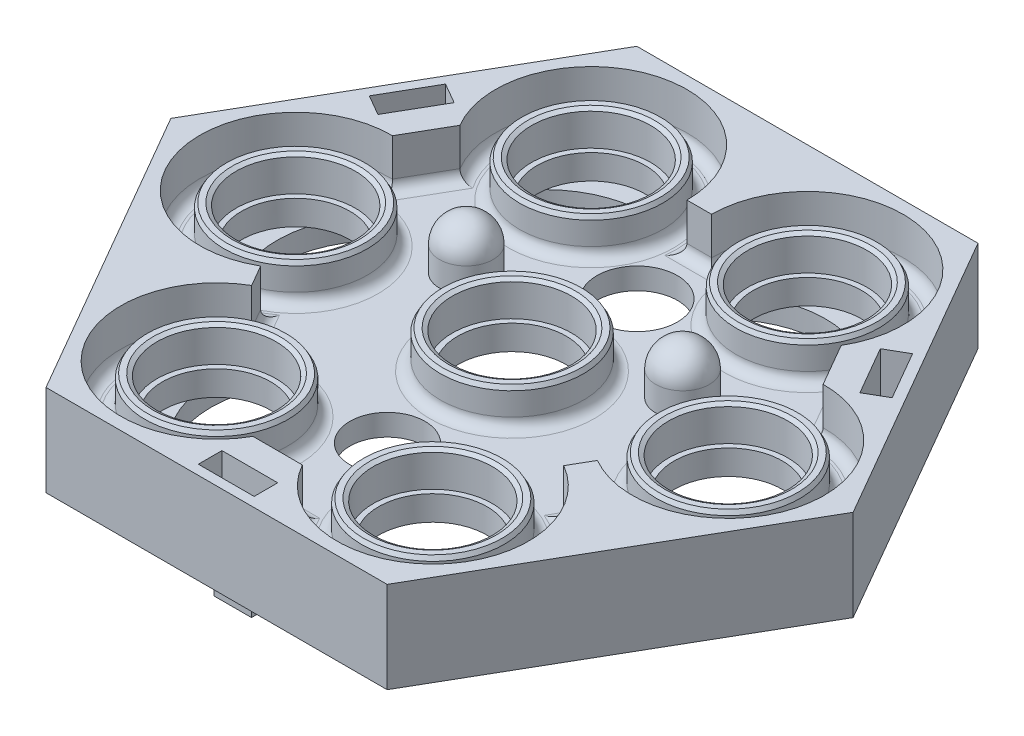
from build123d import *
from OCP.BRepFilletAPI import BRepFilletAPI_MakeChamfer

# Parameters (mm, degrees)
BOSS_EXTRUDE1_DEPTH = 28.05
BOSS_EXTRUDE2_START = -4.004
SKETCH3_R           = 10.1
BOSS_EXTRUDE2_DEPTH = 4.004
SKETCH3_3_R         = 11.1
SKETCH3_3_R_2       = 10.1
BOSS_EXTRUDE3_DEPTH = 0.6
SKETCH3_4_R         = 13.35
SKETCH3_4_R_2       = 11.1
BOSS_EXTRUDE4_DEPTH = 7
CHAMFER1_SIZE       = 0.75
CHAMFER1_SIZE2      = 0.433012702
SKETCH4_W           = 7
SKETCH4_H           = 3
BOSS_EXTRUDE5_DEPTH = 4
SKETCH5_R           = 2.175
CUT_EXTRUDE1_DEPTH  = 11.05
FILLET2_R           = 2
CUT_EXTRUDE2_DEPTH  = 87.445405368
SKETCH7_R           = 2.175
CUT_EXTRUDE3_DEPTH  = 11.05
SKETCH8_R           = 5
BOSS_EXTRUDE6_DEPTH = 4.6
REVOLVE1_ANGLE      = 180
CIRPATTERN1_COUNT   = 2
CIRPATTERN1_ANGLE   = 120
SKETCH10_W          = 10.4
SKETCH10_H          = 4.4
CUT_EXTRUDE4_DEPTH  = 11
BOSS_EXTRUDE7_START = -4
SKETCH11_W          = 7
SKETCH11_H          = 3
BOSS_EXTRUDE7_DEPTH = 4


with BuildPart() as part:
    # Sketch1 → Boss-Extrude1 (new body)
    with BuildSketch(Plane(origin=(0, 0, 0), x_dir=(1, 0, 0), z_dir=(0, 1, 0))):
        with BuildLine():
            ThreePointArc((4.598585794, -43.670987935), (15.441921389, -52.121912551), (29.0763555, -50.361725025))
            Line((29.0763555, -50.361725025), (31.782668218, -55.049196153))
            Line((31.782668218, -55.049196153), (-31.782668218, -55.049196153))
            Line((-31.782668218, -55.049196153), (-63.565336435, 0))
            Line((-63.565336435, 0), (-58.152711, 0))
            ThreePointArc((-58.152711, 0), (-49.22575975, -15.461933122), (-31.37185725, -15.461933122))
            Line((-31.37185725, -15.461933122), (-29.0763555, -19.437858782))
            ThreePointArc((-29.0763555, -19.437858782), (-32.710456807, -47.587651973), (-4.598585794, -43.670987935))
            Line((-4.598585794, -43.670987935), (4.598585794, -43.670987935))
        make_face()
        with BuildLine():
            ThreePointArc((-40.119477858, 17.853001848), (-52.859861057, 12.687860069), (-58.152711, 0))
            Line((-58.152711, 0), (-63.565336435, 0))
            Line((-63.565336435, 0), (-31.782668218, 55.049196153))
            Line((-31.782668218, 55.049196153), (31.782668218, 55.049196153))
            Line((31.782668218, 55.049196153), (29.0763555, 50.361725025))
            ThreePointArc((29.0763555, 50.361725025), (11.222453, 50.361725025), (2.29550175, 34.899791903))
            Line((2.29550175, 34.899791903), (-2.29550175, 34.899791903))
            ThreePointArc((-2.29550175, 34.899791903), (-24.856887111, 52.121912551), (-35.520892063, 25.817986087))
            Line((-35.520892063, 25.817986087), (-40.119477858, 17.853001848))
        make_face()
        with BuildLine():
            ThreePointArc((35.520892063, 25.817986087), (37.417939668, 39.434052481), (29.0763555, 50.361725025))
            Line((29.0763555, 50.361725025), (31.782668218, 55.049196153))
            Line((31.782668218, 55.049196153), (63.565336435, 0))
            Line((63.565336435, 0), (31.782668218, -55.049196153))
            Line((31.782668218, -55.049196153), (29.0763555, -50.361725025))
            ThreePointArc((29.0763555, -50.361725025), (38.00330675, -34.899791903), (29.0763555, -19.437858782))
            Line((29.0763555, -19.437858782), (31.37185725, -15.461933122))
            ThreePointArc((31.37185725, -15.461933122), (57.567343918, -4.534260578), (40.119477858, 17.853001848))
            Line((40.119477858, 17.853001848), (35.520892063, 25.817986087))
        make_face()
    extrude(amount=-BOSS_EXTRUDE1_DEPTH)

    # Sketch3 → Boss-Extrude2 (add)
    with BuildSketch(Plane(origin=(0, -20.046, 0), x_dir=(1, 0, 0), z_dir=(0, 1, 0)).offset(BOSS_EXTRUDE2_START)):
        with BuildLine():
            Line((-31.37185725, -15.461933122), (-29.0763555, -19.437858782))
            ThreePointArc((-29.0763555, -19.437858782), (-32.710456807, -47.587651973), (-4.598585794, -43.670987935))
            Line((-4.598585794, -43.670987935), (4.598585794, -43.670987935))
            ThreePointArc((4.598585794, -43.670987935), (32.710456807, -47.587651973), (29.0763555, -19.437858782))
            Line((29.0763555, -19.437858782), (31.37185725, -15.461933122))
            ThreePointArc((31.37185725, -15.461933122), (57.567343918, -4.534260578), (40.119477858, 17.853001848))
            Line((40.119477858, 17.853001848), (35.520892063, 25.817986087))
            ThreePointArc((35.520892063, 25.817986087), (24.856887111, 52.121912551), (2.29550175, 34.899791903))
            Line((2.29550175, 34.899791903), (-2.29550175, 34.899791903))
            ThreePointArc((-2.29550175, 34.899791903), (-24.856887111, 52.121912551), (-35.520892063, 25.817986087))
            Line((-35.520892063, 25.817986087), (-40.119477858, 17.853001848))
            ThreePointArc((-40.119477858, 17.853001848), (-57.567343918, -4.534260578), (-31.37185725, -15.461933122))
        make_face()
        with Locations(Location((-20.14940425, 34.899791903, 0), (0, 0, 270))):
            Circle(SKETCH3_R, mode=Mode.SUBTRACT)
        with Locations(Location((0, 0, 0), (0, 0, 270))):
            Circle(SKETCH3_R, mode=Mode.SUBTRACT)
        with Locations(Location((20.14940425, 34.899791903, 0), (0, 0, 270))):
            Circle(SKETCH3_R, mode=Mode.SUBTRACT)
        with Locations(Location((40.2988085, 0, 0), (0, 0, 270))):
            Circle(SKETCH3_R, mode=Mode.SUBTRACT)
        with Locations(Location((20.14940425, -34.899791903, 0), (0, 0, 270))):
            Circle(SKETCH3_R, mode=Mode.SUBTRACT)
        with Locations(Location((-20.14940425, -34.899791903, 0), (0, 0, 270))):
            Circle(SKETCH3_R, mode=Mode.SUBTRACT)
        with Locations(Location((-40.2988085, 0, 0), (0, 0, 270))):
            Circle(SKETCH3_R, mode=Mode.SUBTRACT)
    extrude(amount=BOSS_EXTRUDE2_DEPTH)

    # Sketch3<3> → Boss-Extrude3 (add)
    # profile 1 of 7: a face of its own
    with BuildSketch(Plane(origin=(0, -20.046, 0), x_dir=(1, 0, 0), z_dir=(0, 1, 0))):
        with Locations(Location((0, 0, 0), (0, 0, 270))):
            Circle(SKETCH3_3_R)
        with Locations(Location((0, 0, 0), (0, 0, 270))):
            Circle(SKETCH3_3_R_2, mode=Mode.SUBTRACT)
    # profile 2 of 7: a face of its own
    with BuildSketch(Plane(origin=(0, -20.046, 0), x_dir=(1, 0, 0), z_dir=(0, 1, 0))):
        with Locations(Location((-40.2988085, 0, 0), (0, 0, 270))):
            Circle(SKETCH3_3_R)
        with Locations(Location((-40.2988085, 0, 0), (0, 0, 270))):
            Circle(SKETCH3_3_R_2, mode=Mode.SUBTRACT)
    # profile 3 of 7: a face of its own
    with BuildSketch(Plane(origin=(0, -20.046, 0), x_dir=(1, 0, 0), z_dir=(0, 1, 0))):
        with Locations(Location((-20.14940425, 34.899791903, 0), (0, 0, 270))):
            Circle(SKETCH3_3_R)
        with Locations(Location((-20.14940425, 34.899791903, 0), (0, 0, 270))):
            Circle(SKETCH3_3_R_2, mode=Mode.SUBTRACT)
    # profile 4 of 7: a face of its own
    with BuildSketch(Plane(origin=(0, -20.046, 0), x_dir=(1, 0, 0), z_dir=(0, 1, 0))):
        with Locations(Location((-20.14940425, -34.899791903, 0), (0, 0, 270))):
            Circle(SKETCH3_3_R)
        with Locations(Location((-20.14940425, -34.899791903, 0), (0, 0, 270))):
            Circle(SKETCH3_3_R_2, mode=Mode.SUBTRACT)
    # profile 5 of 7: a face of its own
    with BuildSketch(Plane(origin=(0, -20.046, 0), x_dir=(1, 0, 0), z_dir=(0, 1, 0))):
        with Locations(Location((20.14940425, -34.899791903, 0), (0, 0, 270))):
            Circle(SKETCH3_3_R)
        with Locations(Location((20.14940425, -34.899791903, 0), (0, 0, 270))):
            Circle(SKETCH3_3_R_2, mode=Mode.SUBTRACT)
    # profile 6 of 7: a face of its own
    with BuildSketch(Plane(origin=(0, -20.046, 0), x_dir=(1, 0, 0), z_dir=(0, 1, 0))):
        with Locations(Location((20.14940425, 34.899791903, 0), (0, 0, 270))):
            Circle(SKETCH3_3_R)
        with Locations(Location((20.14940425, 34.899791903, 0), (0, 0, 270))):
            Circle(SKETCH3_3_R_2, mode=Mode.SUBTRACT)
    # profile 7 of 7: a face of its own
    with BuildSketch(Plane(origin=(0, -20.046, 0), x_dir=(1, 0, 0), z_dir=(0, 1, 0))):
        with Locations(Location((40.2988085, 0, 0), (0, 0, 270))):
            Circle(SKETCH3_3_R)
        with Locations(Location((40.2988085, 0, 0), (0, 0, 270))):
            Circle(SKETCH3_3_R_2, mode=Mode.SUBTRACT)
    extrude(amount=BOSS_EXTRUDE3_DEPTH)

    # Sketch3<4> → Boss-Extrude4 (add)
    # profile 1 of 7: a face of its own
    with BuildSketch(Plane(origin=(0, -20.046, 0), x_dir=(1, 0, 0), z_dir=(0, 1, 0))):
        with Locations(Location((-40.2988085, 0, 0), (0, 0, 270))):
            Circle(SKETCH3_4_R)
        with Locations(Location((-40.2988085, 0, 0), (0, 0, 270))):
            Circle(SKETCH3_4_R_2, mode=Mode.SUBTRACT)
    # profile 2 of 7: a face of its own
    with BuildSketch(Plane(origin=(0, -20.046, 0), x_dir=(1, 0, 0), z_dir=(0, 1, 0))):
        with Locations(Location((0, 0, 0), (0, 0, 270))):
            Circle(SKETCH3_4_R)
        with Locations(Location((0, 0, 0), (0, 0, 270))):
            Circle(SKETCH3_4_R_2, mode=Mode.SUBTRACT)
    # profile 3 of 7: a face of its own
    with BuildSketch(Plane(origin=(0, -20.046, 0), x_dir=(1, 0, 0), z_dir=(0, 1, 0))):
        with Locations(Location((-20.14940425, 34.899791903, 0), (0, 0, 270))):
            Circle(SKETCH3_4_R)
        with Locations(Location((-20.14940425, 34.899791903, 0), (0, 0, 270))):
            Circle(SKETCH3_4_R_2, mode=Mode.SUBTRACT)
    # profile 4 of 7: a face of its own
    with BuildSketch(Plane(origin=(0, -20.046, 0), x_dir=(1, 0, 0), z_dir=(0, 1, 0))):
        with Locations(Location((-20.14940425, -34.899791903, 0), (0, 0, 270))):
            Circle(SKETCH3_4_R)
        with Locations(Location((-20.14940425, -34.899791903, 0), (0, 0, 270))):
            Circle(SKETCH3_4_R_2, mode=Mode.SUBTRACT)
    # profile 5 of 7: a face of its own
    with BuildSketch(Plane(origin=(0, -20.046, 0), x_dir=(1, 0, 0), z_dir=(0, 1, 0))):
        with Locations(Location((40.2988085, 0, 0), (0, 0, 270))):
            Circle(SKETCH3_4_R)
        with Locations(Location((40.2988085, 0, 0), (0, 0, 270))):
            Circle(SKETCH3_4_R_2, mode=Mode.SUBTRACT)
    # profile 6 of 7: a face of its own
    with BuildSketch(Plane(origin=(0, -20.046, 0), x_dir=(1, 0, 0), z_dir=(0, 1, 0))):
        with Locations(Location((20.14940425, -34.899791903, 0), (0, 0, 270))):
            Circle(SKETCH3_4_R)
        with Locations(Location((20.14940425, -34.899791903, 0), (0, 0, 270))):
            Circle(SKETCH3_4_R_2, mode=Mode.SUBTRACT)
    # profile 7 of 7: a face of its own
    with BuildSketch(Plane(origin=(0, -20.046, 0), x_dir=(1, 0, 0), z_dir=(0, 1, 0))):
        with Locations(Location((20.14940425, 34.899791903, 0), (0, 0, 270))):
            Circle(SKETCH3_4_R)
        with Locations(Location((20.14940425, 34.899791903, 0), (0, 0, 270))):
            Circle(SKETCH3_4_R_2, mode=Mode.SUBTRACT)
    extrude(amount=BOSS_EXTRUDE4_DEPTH)

    # Chamfer1: one chamfer whose edges measure the first distance from different faces: ONE call of the kernel's chamfer builder (chamfer() names one face for all edges)
    chamfer1_edges_1 = [part.edges().sort_by_distance(p)[0] for p in [
        (40.2988085, -13.046, -11.1),
    ]]
    chamfer1_side_1 = [part.faces().sort_by_distance(p)[0] for p in [
        (40.2988085, -13.046, -12.972404979),
    ]]
    chamfer1_edges_2 = [part.edges().sort_by_distance(p)[0] for p in [
        (40.2988085, -13.046, -13.35),
    ]]
    chamfer1_side_2 = [part.faces().sort_by_distance(p)[0] for p in [
        (40.2988085, -16.546, -13.35),
    ]]
    chamfer1_edges_3 = [part.edges().sort_by_distance(p)[0] for p in [
        (-20.14940425, -13.046, 23.799791903),
    ]]
    chamfer1_side_3 = [part.faces().sort_by_distance(p)[0] for p in [
        (-20.14940425, -13.046, 21.927386924),
    ]]
    chamfer1_edges_4 = [part.edges().sort_by_distance(p)[0] for p in [
        (-20.14940425, -13.046, 21.549791903),
    ]]
    chamfer1_side_4 = [part.faces().sort_by_distance(p)[0] for p in [
        (-20.14940425, -16.546, 21.549791903),
    ]]
    chamfer1_edges_5 = [part.edges().sort_by_distance(p)[0] for p in [
        (-20.14940425, -13.046, -45.999791903),
    ]]
    chamfer1_side_5 = [part.faces().sort_by_distance(p)[0] for p in [
        (-20.14940425, -13.046, -47.872196882),
    ]]
    chamfer1_edges_6 = [part.edges().sort_by_distance(p)[0] for p in [
        (-20.14940425, -13.046, -48.249791903),
    ]]
    chamfer1_side_6 = [part.faces().sort_by_distance(p)[0] for p in [
        (-20.14940425, -16.546, -48.249791903),
    ]]
    chamfer1_edges_7 = [part.edges().sort_by_distance(p)[0] for p in [
        (0, -13.046, -11.1),
    ]]
    chamfer1_side_7 = [part.faces().sort_by_distance(p)[0] for p in [
        (0, -13.046, -12.972404979),
    ]]
    chamfer1_edges_8 = [part.edges().sort_by_distance(p)[0] for p in [
        (0, -13.046, -13.35),
    ]]
    chamfer1_side_8 = [part.faces().sort_by_distance(p)[0] for p in [
        (0, -16.546, -13.35),
    ]]
    chamfer1_edges_9 = [part.edges().sort_by_distance(p)[0] for p in [
        (20.14940425, -13.046, 23.799791903),
    ]]
    chamfer1_side_9 = [part.faces().sort_by_distance(p)[0] for p in [
        (20.14940425, -13.046, 21.927386924),
    ]]
    chamfer1_edges_10 = [part.edges().sort_by_distance(p)[0] for p in [
        (20.14940425, -13.046, 21.549791903),
    ]]
    chamfer1_side_10 = [part.faces().sort_by_distance(p)[0] for p in [
        (20.14940425, -16.546, 21.549791903),
    ]]
    chamfer1_edges_11 = [part.edges().sort_by_distance(p)[0] for p in [
        (20.14940425, -13.046, -45.999791903),
    ]]
    chamfer1_side_11 = [part.faces().sort_by_distance(p)[0] for p in [
        (20.14940425, -13.046, -47.872196882),
    ]]
    chamfer1_edges_12 = [part.edges().sort_by_distance(p)[0] for p in [
        (20.14940425, -13.046, -48.249791903),
    ]]
    chamfer1_side_12 = [part.faces().sort_by_distance(p)[0] for p in [
        (20.14940425, -16.546, -48.249791903),
    ]]
    chamfer1_edges_13 = [part.edges().sort_by_distance(p)[0] for p in [
        (-40.2988085, -13.046, -11.1),
    ]]
    chamfer1_side_13 = [part.faces().sort_by_distance(p)[0] for p in [
        (-40.2988085, -13.046, -12.972404979),
    ]]
    chamfer1_edges_14 = [part.edges().sort_by_distance(p)[0] for p in [
        (-40.2988085, -13.046, -13.35),
    ]]
    chamfer1_side_14 = [part.faces().sort_by_distance(p)[0] for p in [
        (-40.2988085, -16.546, -13.35),
    ]]
    chamfer1 = BRepFilletAPI_MakeChamfer(part.part.solid().wrapped)
    for e in chamfer1_edges_1:
        chamfer1.Add(CHAMFER1_SIZE, CHAMFER1_SIZE2, e.wrapped, chamfer1_side_1[0].wrapped)  # the first distance lies on this face
    for e in chamfer1_edges_2:
        chamfer1.Add(CHAMFER1_SIZE, CHAMFER1_SIZE2, e.wrapped, chamfer1_side_2[0].wrapped)  # the first distance lies on this face
    for e in chamfer1_edges_3:
        chamfer1.Add(CHAMFER1_SIZE, CHAMFER1_SIZE2, e.wrapped, chamfer1_side_3[0].wrapped)  # the first distance lies on this face
    for e in chamfer1_edges_4:
        chamfer1.Add(CHAMFER1_SIZE, CHAMFER1_SIZE2, e.wrapped, chamfer1_side_4[0].wrapped)  # the first distance lies on this face
    for e in chamfer1_edges_5:
        chamfer1.Add(CHAMFER1_SIZE, CHAMFER1_SIZE2, e.wrapped, chamfer1_side_5[0].wrapped)  # the first distance lies on this face
    for e in chamfer1_edges_6:
        chamfer1.Add(CHAMFER1_SIZE, CHAMFER1_SIZE2, e.wrapped, chamfer1_side_6[0].wrapped)  # the first distance lies on this face
    for e in chamfer1_edges_7:
        chamfer1.Add(CHAMFER1_SIZE, CHAMFER1_SIZE2, e.wrapped, chamfer1_side_7[0].wrapped)  # the first distance lies on this face
    for e in chamfer1_edges_8:
        chamfer1.Add(CHAMFER1_SIZE, CHAMFER1_SIZE2, e.wrapped, chamfer1_side_8[0].wrapped)  # the first distance lies on this face
    for e in chamfer1_edges_9:
        chamfer1.Add(CHAMFER1_SIZE, CHAMFER1_SIZE2, e.wrapped, chamfer1_side_9[0].wrapped)  # the first distance lies on this face
    for e in chamfer1_edges_10:
        chamfer1.Add(CHAMFER1_SIZE, CHAMFER1_SIZE2, e.wrapped, chamfer1_side_10[0].wrapped)  # the first distance lies on this face
    for e in chamfer1_edges_11:
        chamfer1.Add(CHAMFER1_SIZE, CHAMFER1_SIZE2, e.wrapped, chamfer1_side_11[0].wrapped)  # the first distance lies on this face
    for e in chamfer1_edges_12:
        chamfer1.Add(CHAMFER1_SIZE, CHAMFER1_SIZE2, e.wrapped, chamfer1_side_12[0].wrapped)  # the first distance lies on this face
    for e in chamfer1_edges_13:
        chamfer1.Add(CHAMFER1_SIZE, CHAMFER1_SIZE2, e.wrapped, chamfer1_side_13[0].wrapped)  # the first distance lies on this face
    for e in chamfer1_edges_14:
        chamfer1.Add(CHAMFER1_SIZE, CHAMFER1_SIZE2, e.wrapped, chamfer1_side_14[0].wrapped)  # the first distance lies on this face
    add(Compound.cast(chamfer1.Shape()), mode=Mode.REPLACE)

    # Sketch4 → Boss-Extrude5 (add)
    with BuildSketch(Plane.XZ.offset(28.05)):
        Polygon((-46.825926115, -22.993509163), (-43.325926115, -29.05568699), (-40.727849904, -27.55568699), (-44.227849904, -21.493509163), align=None)
        with Locations((0, 50.549196153)):
            Rectangle(SKETCH4_W, SKETCH4_H)
        Polygon((43.325926115, -29.05568699), (46.825926115, -22.993509163), (44.227849904, -21.493509163), (40.727849904, -27.55568699), align=None)
    extrude(amount=BOSS_EXTRUDE5_DEPTH)

    # Sketch5 → Cut-Extrude1 (cut)
    with BuildSketch(Plane(origin=(0, 0, 0), x_dir=(1, 0, 0), z_dir=(0, 1, 0))):
        with Locations(Location((-42.408567872, -24.484598077, 0), (0, 0, 270))):
            Circle(SKETCH5_R)
        with Locations(Location((0, 48.969196153, 0), (0, 0, 270))):
            Circle(SKETCH5_R)
        with Locations(Location((42.408567872, -24.484598077, 0), (0, 0, 270))):
            Circle(SKETCH5_R)
    extrude(amount=-CUT_EXTRUDE1_DEPTH, mode=Mode.SUBTRACT)

    # Fillet2
    fillet2_edges = [part.edges().sort_by_distance(p)[0] for p in [
        (40.2988085, -20.046, -13.35),
        (-20.14940425, -20.046, 21.549791903),
        (-20.14940425, -20.046, -48.249791903),
        (0, -20.046, -13.35),
        (20.14940425, -20.046, 21.549791903),
        (20.14940425, -20.046, -48.249791903),
        (-40.2988085, -20.046, -13.35),
        (-30.224106375, -20.046, 17.449895952),
        (30.224106375, -20.046, 17.449895952),
        (0, -20.046, -34.899791903),
        (-24.856887111, -20.046, -52.121912551),
        (-37.820184961, -20.046, -21.835493968),
        (-57.567343918, -20.046, 4.534260578),
        (-32.710456807, -20.046, 47.587651973),
        (0, -20.046, 43.670987935),
        (32.710456807, -20.046, 47.587651973),
        (57.567343918, -20.046, 4.534260578),
        (37.820184961, -20.046, -21.835493968),
        (24.856887111, -20.046, -52.121912551),
    ]]
    fillet(fillet2_edges, radius=FILLET2_R)

    # Sketch6 → Cut-Extrude2 (cut, through all)
    with BuildSketch(Plane(origin=(0, -20.046, 0), x_dir=(1, 0, 0), z_dir=(0, 1, 0))):
        with BuildLine():
            ThreePointArc((7, -23.212196153), (4.949747468, -18.262448685), (0, -16.212196153))
            Line((0, -16.212196153), (0, -30.212196153))
            ThreePointArc((0, -30.212196153), (4.949747468, -28.161943622), (7, -23.212196153))
        make_face()
        with BuildLine():
            Line((0, -30.212196153), (0, -16.212196153))
            ThreePointArc((0, -16.212196153), (-7, -23.212196153), (0, -30.212196153))
        make_face()
        with BuildLine():
            ThreePointArc((7.5, 23.322196153), (5.303300859, 28.625497012), (0, 30.822196153))
            Line((0, 30.822196153), (0, 15.822196153))
            ThreePointArc((0, 15.822196153), (5.303300859, 18.018895294), (7.5, 23.322196153))
        make_face()
        with BuildLine():
            Line((0, 15.822196153), (0, 30.822196153))
            ThreePointArc((0, 30.822196153), (-7.5, 23.322196153), (0, 15.822196153))
        make_face()
    extrude(amount=-CUT_EXTRUDE2_DEPTH, mode=Mode.SUBTRACT)

    # Sketch7 → Cut-Extrude3 (cut)
    with BuildSketch(Plane(origin=(0, 0, 0), x_dir=(1, 0, 0), z_dir=(0, 1, 0))):
        Polygon((-63.565336435, 0), (-31.782668218, 55.049196153), (31.782668218, 55.049196153), (63.565336435, 0), (31.782668218, -55.049196153), (-31.782668218, -55.049196153), align=None)
        with Locations((42.408567872, -24.484598077)):
            Circle(SKETCH7_R, mode=Mode.SUBTRACT)
        with Locations((0, 48.969196153)):
            Circle(SKETCH7_R, mode=Mode.SUBTRACT)
        with Locations((-42.408567872, -24.484598077)):
            Circle(SKETCH7_R, mode=Mode.SUBTRACT)
        with BuildLine():
            Line((-2.29550175, 34.899791903), (2.29550175, 34.899791903))
            ThreePointArc((2.29550175, 34.899791903), (24.856887111, 52.121912551), (35.520892063, 25.817986087))
            Line((35.520892063, 25.817986087), (40.119477858, 17.853001848))
            ThreePointArc((40.119477858, 17.853001848), (57.567343918, -4.534260578), (31.37185725, -15.461933122))
            Line((31.37185725, -15.461933122), (29.0763555, -19.437858782))
            ThreePointArc((29.0763555, -19.437858782), (32.710456807, -47.587651973), (4.598585794, -43.670987935))
            Line((4.598585794, -43.670987935), (-4.598585794, -43.670987935))
            ThreePointArc((-4.598585794, -43.670987935), (-32.710456807, -47.587651973), (-29.0763555, -19.437858782))
            Line((-29.0763555, -19.437858782), (-31.37185725, -15.461933122))
            ThreePointArc((-31.37185725, -15.461933122), (-57.567343918, -4.534260578), (-40.119477858, 17.853001848))
            Line((-40.119477858, 17.853001848), (-35.520892063, 25.817986087))
            ThreePointArc((-35.520892063, 25.817986087), (-24.856887111, 52.121912551), (-2.29550175, 34.899791903))
        make_face(mode=Mode.SUBTRACT)
    extrude(amount=-CUT_EXTRUDE3_DEPTH, mode=Mode.SUBTRACT)

    # Sketch8 → Boss-Extrude6 (add)
    with BuildSketch(Plane(origin=(0, -20.046, 0), x_dir=(1, 0, 0), z_dir=(0, 1, 0))):
        with Locations(Location((-20.14940425, 11.633263968, 0), (0, 0, 270))):
            Circle(SKETCH8_R)
    boss_extrude6 = extrude(amount=BOSS_EXTRUDE6_DEPTH)

    # Sketch9 → Revolve1 (revolve)
    with BuildSketch(Plane(origin=(0, -15.446, 0), x_dir=(1, 0, 0), z_dir=(0, 1, 0))):
        with BuildLine():
            Line((-25.14940425, 11.633263968), (-15.14940425, 11.633263968))
            ThreePointArc((-15.14940425, 11.633263968), (-20.14940425, 16.633263968), (-25.14940425, 11.633263968))
        make_face()
    revolve1 = revolve(axis=Axis((-15.14940425, -15.446, -11.633263968), (1, 0, 0)), revolution_arc=REVOLVE1_ANGLE)

    # CirPattern1: Boss-Extrude6, Revolve1 ×2 about axis
    cirpattern1_axis = Axis((0, -185.081080616, 0), (0, -1, 0))
    add([boss_extrude6.rotate(cirpattern1_axis, i * CIRPATTERN1_ANGLE / (CIRPATTERN1_COUNT - 1)) for i in range(1, CIRPATTERN1_COUNT)])
    add([revolve1.rotate(cirpattern1_axis, i * CIRPATTERN1_ANGLE / (CIRPATTERN1_COUNT - 1)) for i in range(1, CIRPATTERN1_COUNT)])

    # Sketch10 → Cut-Extrude4 (cut)
    with BuildSketch(Plane(origin=(0, -11.05, 0), x_dir=(1, 0, 0), z_dir=(0, 1, 0))):
        with Locations((0, -51.049196153)):
            Rectangle(SKETCH10_W, SKETCH10_H)
        Polygon((-39.704644823, 28.927930176), (-43.5151566, 31.127930176), (-48.7151566, 22.121265977), (-44.904644823, 19.921265977), align=None)
        Polygon((44.904644823, 19.921265977), (48.7151566, 22.121265977), (43.5151566, 31.127930176), (39.704644823, 28.927930176), align=None)
    extrude(amount=-CUT_EXTRUDE4_DEPTH, mode=Mode.SUBTRACT)

    # Sketch11 → Boss-Extrude7 (add)
    # profile 1 of 7: a face of its own
    with BuildSketch(Plane.XZ.offset(28.05).offset(BOSS_EXTRUDE7_START)):
        Polygon((31.782668218, 55.049196153), (-31.782668218, 55.049196153), (-63.565336435, 0), (-31.782668218, -55.049196153), (31.782668218, -55.049196153), (63.565336435, 0), align=None)
        Polygon((-43.325926115, -29.05568699), (-46.825926115, -22.993509163), (-44.227849904, -21.493509163), (-40.727849904, -27.55568699), align=None, mode=Mode.SUBTRACT)
        Polygon((46.825926115, -22.993509163), (43.325926115, -29.05568699), (40.727849904, -27.55568699), (44.227849904, -21.493509163), align=None, mode=Mode.SUBTRACT)
        with BuildLine():
            ThreePointArc((-29.0763555, 19.437858782), (-32.710456807, 47.587651973), (-4.598585794, 43.670987935))
            Line((-4.598585794, 43.670987935), (4.598585794, 43.670987935))
            ThreePointArc((4.598585794, 43.670987935), (32.710456807, 47.587651973), (29.0763555, 19.437858782))
            Line((29.0763555, 19.437858782), (31.37185725, 15.461933122))
            ThreePointArc((31.37185725, 15.461933122), (57.567343918, 4.534260578), (40.119477858, -17.853001848))
            Line((40.119477858, -17.853001848), (35.520892063, -25.817986087))
            ThreePointArc((35.520892063, -25.817986087), (24.856887111, -52.121912551), (2.29550175, -34.899791903))
            Line((2.29550175, -34.899791903), (-1.988725071, -34.899791903))
            ThreePointArc((-1.988725071, -34.899791903), (-2.142876764, -35.087960588), (-2.29942669, -35.274138781))
            ThreePointArc((-2.29942669, -35.274138781), (-25.03718839, -52.071611862), (-35.520892063, -25.817986087))
            Line((-35.520892063, -25.817986087), (-40.119477858, -17.853001848))
            ThreePointArc((-40.119477858, -17.853001848), (-57.567343918, 4.534260578), (-31.37185725, 15.461933122))
            Line((-31.37185725, 15.461933122), (-29.0763555, 19.437858782))
        make_face(mode=Mode.SUBTRACT)
        with Locations((0, 50.549196153)):
            Rectangle(SKETCH11_W, SKETCH11_H, mode=Mode.SUBTRACT)
    # profile 2 of 7: a face of its own
    with BuildSketch(Plane.XZ.offset(28.05).offset(BOSS_EXTRUDE7_START)):
        with BuildLine():
            ThreePointArc((-2.29942669, -35.274138781), (-21.949158573, -41.222709675), (-35.520892063, -25.817986087))
            ThreePointArc((-35.520892063, -25.817986087), (-25.03718839, -52.071611862), (-2.29942669, -35.274138781))
        make_face()
    # profile 3 of 7: a face of its own
    with BuildSketch(Plane.XZ.offset(28.05).offset(BOSS_EXTRUDE7_START)):
        with BuildLine():
            ThreePointArc((-31.37185725, 15.461933122), (-46.380711318, 1.596946789), (-40.119477858, -17.853001848))
            ThreePointArc((-40.119477858, -17.853001848), (-57.567343918, 4.534260578), (-31.37185725, 15.461933122))
        make_face()
    # profile 4 of 7: a face of its own
    with BuildSketch(Plane.XZ.offset(28.05).offset(BOSS_EXTRUDE7_START)):
        with BuildLine():
            ThreePointArc((-4.598585794, 43.670987935), (-24.573352147, 39.368400853), (-29.0763555, 19.437858782))
            ThreePointArc((-29.0763555, 19.437858782), (-32.710456807, 47.587651973), (-4.598585794, 43.670987935))
        make_face()
    # profile 5 of 7: a face of its own
    with BuildSketch(Plane.XZ.offset(28.05).offset(BOSS_EXTRUDE7_START)):
        with BuildLine():
            ThreePointArc((29.0763555, 19.437858782), (24.573352147, 39.368400853), (4.598585794, 43.670987935))
            ThreePointArc((4.598585794, 43.670987935), (32.710456807, 47.587651973), (29.0763555, 19.437858782))
        make_face()
    # profile 6 of 7: a face of its own
    with BuildSketch(Plane.XZ.offset(28.05).offset(BOSS_EXTRUDE7_START)):
        with BuildLine():
            ThreePointArc((40.119477858, -17.853001848), (46.380711318, 1.596946789), (31.37185725, 15.461933122))
            ThreePointArc((31.37185725, 15.461933122), (57.567343918, 4.534260578), (40.119477858, -17.853001848))
        make_face()
    # profile 7 of 7: a face of its own
    with BuildSketch(Plane.XZ.offset(28.05).offset(BOSS_EXTRUDE7_START)):
        with BuildLine():
            ThreePointArc((2.29550175, -34.899791903), (21.807359171, -40.965347642), (35.520892063, -25.817986087))
            ThreePointArc((35.520892063, -25.817986087), (24.856887111, -52.121912551), (2.29550175, -34.899791903))
        make_face()
    extrude(amount=BOSS_EXTRUDE7_DEPTH)


solid = part.part
